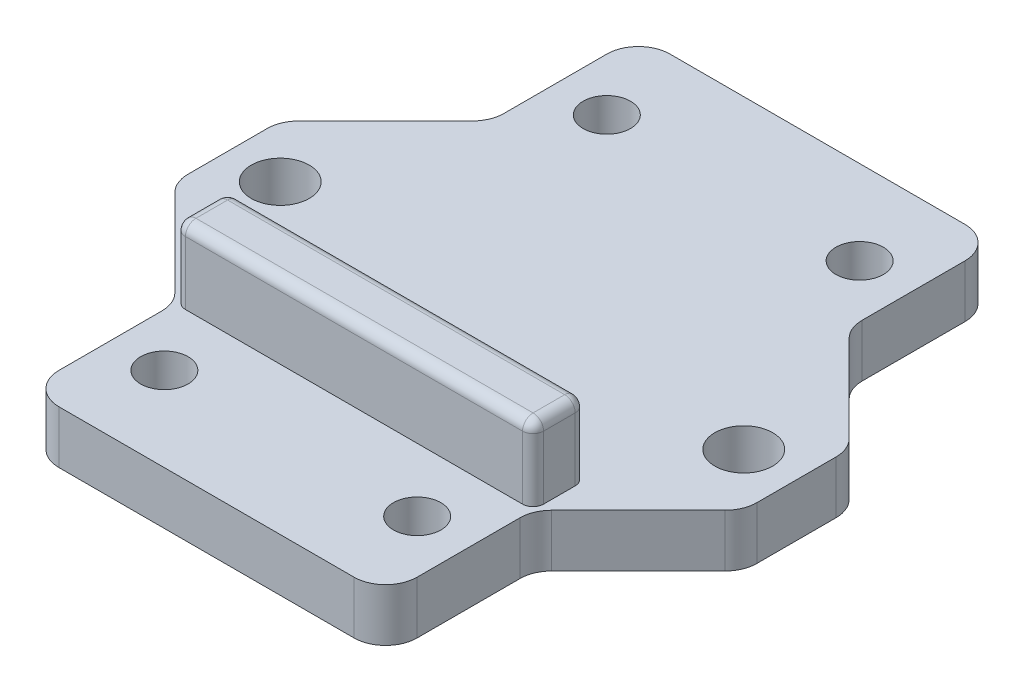
from build123d import *

# Parameters (mm, degrees)
SKETCH1_R           = 2.25
SKETCH1_R_2         = 2.75
BOSS_EXTRUDE1_DEPTH = 2.5
FILLET2_R           = 3
SKETCH2_W           = 34
SKETCH2_H           = 5
BOSS_EXTRUDE2_DEPTH = 7
FILLET3_R           = 1


with BuildPart() as part:
    # Sketch1 → Boss-Extrude1 (new, symmetric)
    with BuildSketch(Plane(origin=(0, 0, 0), x_dir=(1, 0, 0), z_dir=(0, 1, 0))):
        Polygon((-17, -29), (17, -29), (17, -15), (27, -5), (27, 5), (17, 15), (17, 29), (-17, 29), (-17, 15), (-27, 5), (-27, -5), (-17, -15), align=None)
        with Locations(Location((-12, 21, 0), (0, 0, 270))):
            Circle(SKETCH1_R, mode=Mode.SUBTRACT)
        with Locations(Location((12, 21, 0), (0, 0, 270))):
            Circle(SKETCH1_R, mode=Mode.SUBTRACT)
        with Locations(Location((-12, -21, 0), (0, 0, 270))):
            Circle(SKETCH1_R, mode=Mode.SUBTRACT)
        with Locations(Location((12, -21, 0), (0, 0, 270))):
            Circle(SKETCH1_R, mode=Mode.SUBTRACT)
        with Locations(Location((-22, 0, 0), (0, 0, 270))):
            Circle(SKETCH1_R_2, mode=Mode.SUBTRACT)
        with Locations(Location((22, 0, 0), (0, 0, 90))):
            Circle(SKETCH1_R_2, mode=Mode.SUBTRACT)
    extrude(amount=BOSS_EXTRUDE1_DEPTH, both=True)

    # Fillet2
    fillet2_edges = [part.edges().sort_by_distance(p)[0] for p in [
        (17, 0, -15),
        (27, 0, -5),
        (27, 0, 5),
        (17, 0, 15),
        (17, 0, 29),
        (-17, 0, 29),
        (-17, 0, 15),
        (-27, 0, 5),
        (-27, 0, -5),
        (-17, 0, -15),
        (-17, 0, -29),
        (17, 0, -29),
    ]]
    fillet(fillet2_edges, radius=FILLET2_R)

    # Sketch2 → Boss-Extrude2 (add)
    with BuildSketch(Plane(origin=(0, 2.5, 0), x_dir=(1, 0, 0), z_dir=(0, 1, 0))):
        with Locations((0, -12.5)):
            Rectangle(SKETCH2_W, SKETCH2_H)
    extrude(amount=BOSS_EXTRUDE2_DEPTH)

    # Fillet3
    fillet3_edges = [part.edges().sort_by_distance(p)[0] for p in [
        (-17, 6, 10),
        (-17, 6, 15),
        (17, 6, 15),
        (17, 6, 10),
        (-17, 9.5, 12.5),
        (0, 9.5, 15),
        (17, 9.5, 12.5),
        (0, 9.5, 10),
    ]]
    fillet(fillet3_edges, radius=FILLET3_R)


solid = part.part
